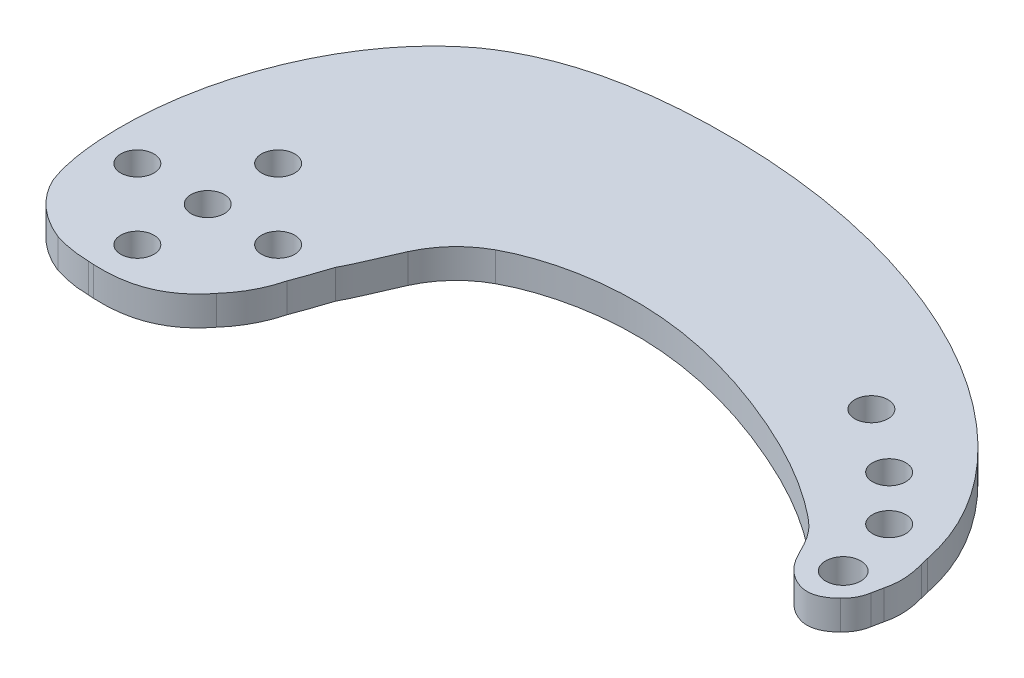
from build123d import *

# Parameters (mm, degrees)
SKETCH_1_R          = 1.7
EXTRUDE_1_DEPTH     = 3
CUT_EXTRUDE_3_DEPTH = 3
SKETCH_3_R          = 1.7
EXTRUDE_3_DEPTH     = 3
FILLET_9_R          = 10
FILLET_10_R         = 10
FILLET_14_R         = 20
EXTRUDE_4_DEPTH     = 3
CUT_EXTRUDE_4_DEPTH = 3
EXTRUDE_6_DEPTH     = 3
FILLET_20_R         = 10
FILLET_21_R         = 10
SKETCH_8_R          = 1.8
CUT_EXTRUDE_5_DEPTH = 3
SKETCH_9_R          = 1.7
CUT_EXTRUDE_6_DEPTH = 10


with BuildPart() as part:
    # 草图1 → 凸台-拉伸1 (new body)
    # profile 1 of 23: a face of its own
    with BuildSketch(Plane(origin=(0, 0, 0), x_dir=(1, 0, 0), z_dir=(0, 1, 0))):
        with BuildLine():
            ThreePointArc((5.5, 0), (7.2, 1.7), (8.9, 0))
            Line((8.9, 0), (11.2, 0))
            ThreePointArc((11.2, 0), (9.208552546, 6.375151763), (3.9424, 10.4832))
            ThreePointArc((3.9424, 10.4832), (2.837711379, 10.834546328), (1.702623658, 11.06982713))
            ThreePointArc((1.702623658, 11.06982713), (-7.292825757, 8.500276024), (-11.2, 0))
            Line((-11.2, 0), (-8.9, 0))
            ThreePointArc((-8.9, 0), (-7.2, 1.7), (-5.5, 0))
            Line((-5.5, 0), (-1.7, 0))
            ThreePointArc((-1.7, 0), (0, 1.7), (1.7, 0))
            Line((1.7, 0), (5.5, 0))
        make_face()
        with Locations(Location((0, 7.2, 0), (0, 0, 270))):
            Circle(SKETCH_1_R, mode=Mode.SUBTRACT)
    # profile 2 of 23: a face of its own
    with BuildSketch(Plane(origin=(0, 0, 0), x_dir=(1, 0, 0), z_dir=(0, 1, 0))):
        with BuildLine():
            Line((11.2, 0), (8.9, 0))
            ThreePointArc((8.9, 0), (7.2, -1.7), (5.5, 0))
            Line((5.5, 0), (1.7, 0))
            ThreePointArc((1.7, 0), (0, -1.7), (-1.7, 0))
            Line((-1.7, 0), (-5.5, 0))
            ThreePointArc((-5.5, 0), (-7.2, -1.7), (-8.9, 0))
            Line((-8.9, 0), (-11.2, 0))
            ThreePointArc((-11.2, 0), (0, -11.2), (11.2, 0))
        make_face()
        with Locations(Location((0, -7.2, 0), (0, 0, 270))):
            Circle(SKETCH_1_R, mode=Mode.SUBTRACT)
    # profile 3 of 23: a face of its own
    with BuildSketch(Plane(origin=(0, 0, 0), x_dir=(1, 0, 0), z_dir=(0, 1, 0))):
        with BuildLine():
            ThreePointArc((36.4, 25.2), (54.219090886, 17.819090886), (61.6, 0))
            ThreePointArc((61.6, 0), (62.902494764, 2.675905788), (65.812042226, 3.301603765))
            ThreePointArc((65.812042226, 3.301603765), (37.256587325, 36.064283099), (1.702623658, 11.06982713))
            ThreePointArc((1.702623658, 11.06982713), (2.837711379, 10.834546328), (3.9424, 10.4832))
            ThreePointArc((3.9424, 10.4832), (17.872608925, 22.911095384), (36.4, 25.2))
        make_face()
    # profile 4 of 23: a face of its own
    with BuildSketch(Plane(origin=(0, 0, 0), x_dir=(1, 0, 0), z_dir=(0, 1, 0))):
        with BuildLine():
            ThreePointArc((68.4, 0), (28.6, 39.8), (-11.2, 0))
            ThreePointArc((-11.2, 0), (-7.292825757, 8.500276024), (1.702623658, 11.06982713))
            ThreePointArc((1.702623658, 11.06982713), (37.256587325, 36.064283099), (65.812042226, 3.301603765))
            ThreePointArc((65.812042226, 3.301603765), (67.675905788, 2.097505236), (68.4, 0))
        make_face()
    # profile 5 of 23: a face of its own
    with BuildSketch(Plane(origin=(0, 0, 0), x_dir=(1, 0, 0), z_dir=(0, 1, 0))):
        with BuildLine():
            ThreePointArc((3.9424, 10.4832), (9.208552546, 6.375151763), (11.2, 0))
            ThreePointArc((11.2, 0), (18.580909114, 17.819090886), (36.4, 25.2))
            ThreePointArc((36.4, 25.2), (17.872608925, 22.911095384), (3.9424, 10.4832))
        make_face()
    # profile 6 of 23: a face of its own
    with BuildSketch(Plane(origin=(0, 0, 0), x_dir=(1, 0, 0), z_dir=(0, 1, 0))):
        with BuildLine():
            ThreePointArc((36.4, 25.2), (52.935943621, 16.535943621), (61.6, 0))
            ThreePointArc((61.6, 0), (54.219090886, 17.819090886), (36.4, 25.2))
        make_face()
    # profile 7 of 23: a face of its own
    with BuildSketch(Plane(origin=(0, 0, 0), x_dir=(1, 0, 0), z_dir=(0, 1, 0))):
        with BuildLine():
            ThreePointArc((65.812042226, 3.301603765), (62.902494764, 2.675905788), (61.6, 0))
            Line((61.6, 0), (63.3, 0))
            ThreePointArc((63.3, 0), (64.094189641, 1.438578324), (65.734714816, 1.533034291))
            ThreePointArc((65.734714816, 1.533034291), (65.785435342, 2.416791866), (65.812042226, 3.301603765))
        make_face()
    # profile 8 of 23: a face of its own
    with BuildSketch(Plane(origin=(0, 0, 0), x_dir=(1, 0, 0), z_dir=(0, 1, 0))):
        with BuildLine():
            Line((63.3, 0), (61.6, 0))
            ThreePointArc((61.6, 0), (62.595836944, -2.404163056), (65, -3.4))
            ThreePointArc((65, -3.4), (65.185488011, -2.534439938), (65.347308419, -1.664144483))
            ThreePointArc((65.347308419, -1.664144483), (63.927718394, -1.319171011), (63.3, 0))
        make_face()
    # profile 9 of 23: a face of its own
    with BuildSketch(Plane(origin=(0, 0, 0), x_dir=(1, 0, 0), z_dir=(0, 1, 0))):
        with BuildLine():
            ThreePointArc((65.347308419, -1.664144483), (65.185488011, -2.534439938), (65, -3.4))
            ThreePointArc((65, -3.4), (67.404163056, -2.404163056), (68.4, 0))
            Line((68.4, 0), (66.7, 0))
            ThreePointArc((66.7, 0), (66.319171011, -1.072281606), (65.347308419, -1.664144483))
        make_face()
    # profile 10 of 23: a face of its own
    with BuildSketch(Plane(origin=(0, 0, 0), x_dir=(1, 0, 0), z_dir=(0, 1, 0))):
        with BuildLine():
            ThreePointArc((68.4, 0), (67.675905788, 2.097505236), (65.812042226, 3.301603765))
            ThreePointArc((65.812042226, 3.301603765), (65.785435342, 2.416791866), (65.734714816, 1.533034291))
            ThreePointArc((65.734714816, 1.533034291), (66.438578324, 0.905810359), (66.7, 0))
            Line((66.7, 0), (68.4, 0))
        make_face()
    # profile 11 of 23: a face of its own
    with BuildSketch(Plane(origin=(0, 0, 0), x_dir=(1, 0, 0), z_dir=(0, 1, 0))):
        with BuildLine():
            ThreePointArc((65.812042226, 3.301603765), (62.902494764, 2.675905788), (61.6, 0))
            Line((61.6, 0), (63.3, 0))
            ThreePointArc((63.3, 0), (64.094189641, 1.438578324), (65.734714816, 1.533034291))
            ThreePointArc((65.734714816, 1.533034291), (65.785435342, 2.416791866), (65.812042226, 3.301603765))
        make_face()
    # profile 12 of 23: a face of its own
    with BuildSketch(Plane(origin=(0, 0, 0), x_dir=(1, 0, 0), z_dir=(0, 1, 0))):
        with BuildLine():
            Line((63.3, 0), (61.6, 0))
            ThreePointArc((61.6, 0), (62.595836944, -2.404163056), (65, -3.4))
            ThreePointArc((65, -3.4), (65.185488011, -2.534439938), (65.347308419, -1.664144483))
            ThreePointArc((65.347308419, -1.664144483), (63.927718394, -1.319171011), (63.3, 0))
        make_face()
    # profile 13 of 23: a face of its own
    with BuildSketch(Plane(origin=(0, 0, 0), x_dir=(1, 0, 0), z_dir=(0, 1, 0))):
        with BuildLine():
            ThreePointArc((65.347308419, -1.664144483), (65.185488011, -2.534439938), (65, -3.4))
            ThreePointArc((65, -3.4), (67.404163056, -2.404163056), (68.4, 0))
            Line((68.4, 0), (66.7, 0))
            ThreePointArc((66.7, 0), (66.319171011, -1.072281606), (65.347308419, -1.664144483))
        make_face()
    # profile 14 of 23: a face of its own
    with BuildSketch(Plane(origin=(0, 0, 0), x_dir=(1, 0, 0), z_dir=(0, 1, 0))):
        with BuildLine():
            ThreePointArc((68.4, 0), (67.675905788, 2.097505236), (65.812042226, 3.301603765))
            ThreePointArc((65.812042226, 3.301603765), (65.785435342, 2.416791866), (65.734714816, 1.533034291))
            ThreePointArc((65.734714816, 1.533034291), (66.438578324, 0.905810359), (66.7, 0))
            Line((66.7, 0), (68.4, 0))
        make_face()
    # profile 15 of 23: a face of its own
    with BuildSketch(Plane(origin=(0, 0, 0), x_dir=(1, 0, 0), z_dir=(0, 1, 0))):
        with BuildLine():
            ThreePointArc((65.812042226, 3.301603765), (62.902494764, 2.675905788), (61.6, 0))
            Line((61.6, 0), (63.3, 0))
            ThreePointArc((63.3, 0), (64.094189641, 1.438578324), (65.734714816, 1.533034291))
            ThreePointArc((65.734714816, 1.533034291), (65.785435342, 2.416791866), (65.812042226, 3.301603765))
        make_face()
    # profile 16 of 23: a face of its own
    with BuildSketch(Plane(origin=(0, 0, 0), x_dir=(1, 0, 0), z_dir=(0, 1, 0))):
        with BuildLine():
            Line((63.3, 0), (61.6, 0))
            ThreePointArc((61.6, 0), (62.595836944, -2.404163056), (65, -3.4))
            ThreePointArc((65, -3.4), (65.185488011, -2.534439938), (65.347308419, -1.664144483))
            ThreePointArc((65.347308419, -1.664144483), (63.927718394, -1.319171011), (63.3, 0))
        make_face()
    # profile 17 of 23: a face of its own
    with BuildSketch(Plane(origin=(0, 0, 0), x_dir=(1, 0, 0), z_dir=(0, 1, 0))):
        with BuildLine():
            ThreePointArc((65.347308419, -1.664144483), (65.185488011, -2.534439938), (65, -3.4))
            ThreePointArc((65, -3.4), (67.404163056, -2.404163056), (68.4, 0))
            Line((68.4, 0), (66.7, 0))
            ThreePointArc((66.7, 0), (66.319171011, -1.072281606), (65.347308419, -1.664144483))
        make_face()
    # profile 18 of 23: a face of its own
    with BuildSketch(Plane(origin=(0, 0, 0), x_dir=(1, 0, 0), z_dir=(0, 1, 0))):
        with BuildLine():
            ThreePointArc((68.4, 0), (67.675905788, 2.097505236), (65.812042226, 3.301603765))
            ThreePointArc((65.812042226, 3.301603765), (65.785435342, 2.416791866), (65.734714816, 1.533034291))
            ThreePointArc((65.734714816, 1.533034291), (66.438578324, 0.905810359), (66.7, 0))
            Line((66.7, 0), (68.4, 0))
        make_face()
    # profile 19 of 23: a face of its own
    with BuildSketch(Plane(origin=(0, 0, 0), x_dir=(1, 0, 0), z_dir=(0, 1, 0))):
        with BuildLine():
            ThreePointArc((65.812042226, 3.301603765), (62.902494764, 2.675905788), (61.6, 0))
            Line((61.6, 0), (63.3, 0))
            ThreePointArc((63.3, 0), (64.094189641, 1.438578324), (65.734714816, 1.533034291))
            ThreePointArc((65.734714816, 1.533034291), (65.785435342, 2.416791866), (65.812042226, 3.301603765))
        make_face()
    # profile 20 of 23: a face of its own
    with BuildSketch(Plane(origin=(0, 0, 0), x_dir=(1, 0, 0), z_dir=(0, 1, 0))):
        with BuildLine():
            Line((63.3, 0), (61.6, 0))
            ThreePointArc((61.6, 0), (62.595836944, -2.404163056), (65, -3.4))
            ThreePointArc((65, -3.4), (65.185488011, -2.534439938), (65.347308419, -1.664144483))
            ThreePointArc((65.347308419, -1.664144483), (63.927718394, -1.319171011), (63.3, 0))
        make_face()
    # profile 21 of 23: a face of its own
    with BuildSketch(Plane(origin=(0, 0, 0), x_dir=(1, 0, 0), z_dir=(0, 1, 0))):
        with BuildLine():
            ThreePointArc((65.347308419, -1.664144483), (65.185488011, -2.534439938), (65, -3.4))
            ThreePointArc((65, -3.4), (67.404163056, -2.404163056), (68.4, 0))
            Line((68.4, 0), (66.7, 0))
            ThreePointArc((66.7, 0), (66.319171011, -1.072281606), (65.347308419, -1.664144483))
        make_face()
    # profile 22 of 23: a face of its own
    with BuildSketch(Plane(origin=(0, 0, 0), x_dir=(1, 0, 0), z_dir=(0, 1, 0))):
        with BuildLine():
            ThreePointArc((68.4, 0), (67.675905788, 2.097505236), (65.812042226, 3.301603765))
            ThreePointArc((65.812042226, 3.301603765), (65.785435342, 2.416791866), (65.734714816, 1.533034291))
            ThreePointArc((65.734714816, 1.533034291), (66.438578324, 0.905810359), (66.7, 0))
            Line((66.7, 0), (68.4, 0))
        make_face()
    # profile 23 of 23: a face of its own
    with BuildSketch(Plane(origin=(0, 0, 0), x_dir=(1, 0, 0), z_dir=(0, 1, 0))):
        with BuildLine():
            ThreePointArc((36.4, 25.2), (18.580909114, 17.819090886), (11.2, 0))
            Line((11.2, 0), (61.6, 0))
            ThreePointArc((61.6, 0), (52.935943621, 16.535943621), (36.4, 25.2))
        make_face()
    extrude(amount=EXTRUDE_1_DEPTH)

    # 草图2 → 切除-拉伸3 (cut)
    with BuildSketch(Plane(origin=(0, 0, 0), x_dir=(1, 0, 0), z_dir=(0, 1, 0))):
        with BuildLine():
            Line((68.849577541, -5.350147526), (79.418255921, 26.798886108))
            Line((79.418255921, 26.798886108), (41.510241853, 45.721250392))
            Line((41.510241853, 45.721250392), (-3.738890131, 40.215411955))
            Line((-3.738890131, 40.215411955), (-19.437922992, 8.764841107))
            Line((-19.437922992, 8.764841107), (-13.991141015, 0))
            Line((-13.991141015, 0), (-11.2, 0))
            add(Edge.make_bspline(
                [(-11.2, 0), (-10.98570603, 9.511964616), (-6.790384007, 26.883440864), (30.257690246, 38.217930428), (69.370809067, 18.750082571), (68.849577541, -5.350147526)],
                knots=[0, 0, 0, 0, 0.267985993, 0.373432138, 1, 1, 1, 1], degree=3))
        make_face()
        with BuildLine():
            Line((11.2, 0), (61.6, 0))
            add(Edge.make_bspline(
                [(11.2, 0), (14.907237051, 24.878878013), (54.036546726, 12.1796003), (61.6, 0)],
                knots=[0, 0, 0, 0, 1, 1, 1, 1], degree=3))
        make_face()
    extrude(amount=CUT_EXTRUDE_3_DEPTH, mode=Mode.SUBTRACT)

    # 草图3 → 凸台-拉伸3 (add)
    with BuildSketch(Plane(origin=(0, 0, 0), x_dir=(1, 0, 0), z_dir=(0, 1, 0))):
        with Locations((65, 0)):
            Circle(SKETCH_3_R)
        with BuildLine():
            add(Edge.make_bspline(
                [(11.2, 0), (12.445613849, -0.056946933), (16.571407935, 16.802360329), (35.788824905, 14.252683642), (51.249640161, 9.442422377), (60.238259143, 2.741563074), (64.770360278, -5.187357593), (69.206577143, -0.002495132), (68.396099439, 6.376713893), (55.968118328, 24.950216267), (5.625904457, 36.508565927), (9.990497003, 0.055296018), (11.2, 0)],
                knots=[0, 0, 0, 0, 0.081161217, 0.198317789, 0.331056992, 0.406547513, 0.438622354, 0.470697196, 0.501390038, 0.565670643, 0.92119168, 1, 1, 1, 1], degree=3))
        make_face()
    extrude(amount=EXTRUDE_3_DEPTH)

    # 圆角9
    fillet_9_edges = [part.edges().sort_by_distance(p)[0] for p in [
        (17.059648691, 1.5, -10.662861344),
        (11.2, 1.5, 0),
    ]]
    fillet(fillet_9_edges, radius=FILLET_9_R)

    # 圆角10
    fillet_10_edges = [part.edges().sort_by_distance(p)[0] for p in [
        (68.4, 1.5, 0),
        (61.6, 1.5, 0),
    ]]
    fillet(fillet_10_edges, radius=FILLET_10_R)

    # 圆角14
    fillet_14_edges = [part.edges().sort_by_distance(p)[0] for p in [
        (59.25376733, 1.5, -16.163619627),
    ]]
    fillet(fillet_14_edges, radius=FILLET_14_R)

    # 草图4 → 凸台-拉伸4 (add)
    with BuildSketch(Plane(origin=(0, 0, 0), x_dir=(1, 0, 0), z_dir=(0, 1, 0))):
        with BuildLine():
            Line((5.205364174, -8.263457931), (-0.456140463, -10.299055104))
            Line((-0.456140463, -10.299055104), (-8.725753977, -3.492527057))
            Line((-8.725753977, -3.492527057), (-9.61632774, 1.660078286))
            Line((-9.61632774, 1.660078286), (-4.051653355, 17.482622071))
            Line((-4.051653355, 17.482622071), (31.159228128, 24.115259599))
            Line((31.159228128, 24.115259599), (64.810193891, 6.04933469))
            Line((64.810193891, 6.04933469), (67.227465534, 0))
            Line((67.227465534, 0), (68.363274916, -0.498379212))
            add(Edge.make_bspline(
                [(68.363274916, -0.498379212), (69.532708963, 7.730280313), (60.738469504, 20.627242961), (41.024169704, 30.636446502), (20.620918144, 33.805709868), (-5.259875882, 29.990734693), (-13.072652033, 6.858797725), (-10.268154966, -6.40085846), (-7.775524094, -9.61750499), (-6.466783991, -9.922623082), (-2.26188398, -11.569131778), (2.33580519, -11.773246089), (5.205364174, -8.263457931)],
                knots=[0, 0, 0, 0, 0.167183895, 0.308915578, 0.466622559, 0.613185698, 0.827690468, 0.89009779, 0.902058544, 0.911312027, 0.918105774, 1, 1, 1, 1], degree=3))
        make_face()
    extrude(amount=EXTRUDE_4_DEPTH)

    # 草图6 → 切除-拉伸4 (cut)
    with BuildSketch(Plane(origin=(0, 0, 0), x_dir=(1, 0, 0), z_dir=(0, 1, 0))):
        with BuildLine():
            Line((6.198074913, 30.769413247), (-15.201438159, 29.11441495))
            Line((-15.201438159, 29.11441495), (-14.174464608, -13.890102476))
            Line((-14.174464608, -13.890102476), (0, -13.551607799))
            Line((0, -13.551607799), (-1.07082991, -11.148691551))
            add(Edge.make_bspline(
                [(-1.07082991, -11.148691551), (-4.632098822, -11.372542323), (-9.743745913, -8.365778862), (-10.905982833, -2.80619952), (-12.563842534, 11.227564879), (-5.891605094, 27.30233233), (6.198074913, 30.769413247)],
                knots=[0, 0, 0, 0, 0.203093444, 0.264365632, 0.313017022, 1, 1, 1, 1], degree=3))
        make_face()
    extrude(amount=CUT_EXTRUDE_4_DEPTH, mode=Mode.SUBTRACT)

    # 草图7 → 凸台-拉伸6 (add)
    with BuildSketch(Plane(origin=(0, 3, 0), x_dir=(1, 0, 0), z_dir=(0, 1, 0))):
        with BuildLine():
            Line((67.267592809, -2.533381703), (62.796727439, -1.544387585))
            Line((62.796727439, -1.544387585), (59.283028619, 6.962462189))
            Line((59.283028619, 6.962462189), (25.589630625, 20.161737938))
            Line((25.589630625, 20.161737938), (9.982664815, 8.020864686))
            Line((9.982664815, 8.020864686), (9.982664815, 0))
            Line((9.982664815, 0), (6.138584566, -6.823705409))
            Line((6.138584566, -6.823705409), (-0.550115067, -10.360259238))
            Line((-0.550115067, -10.360259238), (-1.07082991, -11.148691551))
            add(Edge.make_bspline(
                [(-1.07082991, -11.148691551), (7.812669668, -11.919550611), (10.96181155, -2.856059757), (14.781270798, 9.242340193), (28.533124839, 15.181959499), (44.177561896, 11.550637389), (55.332290754, 5.54631354), (59.457312788, 2.134315772), (60.7283813, 0.393004228), (61.584454582, -1.828142583), (63.337302433, -3.344243945), (65.436862479, -3.898295904), (66.710060657, -3.145429133), (67.267592809, -2.533381703)],
                knots=[0, 0, 0, 0, 0.226108574, 0.31746352, 0.429095875, 0.705433638, 0.851538596, 0.872297984, 0.892425071, 0.926476328, 0.954706086, 0.970022879, 1, 1, 1, 1], degree=3))
        make_face()
    extrude(amount=-EXTRUDE_6_DEPTH)

    # 圆角20
    fillet_20_edges = [part.edges().sort_by_distance(p)[0] for p in [
        (15.414387437, 1.5, -8.020864686),
    ]]
    fillet(fillet_20_edges, radius=FILLET_20_R)

    # 圆角21
    fillet_21_edges = [part.edges().sort_by_distance(p)[0] for p in [
        (68.280862162, 1.5, -5.005189784),
    ]]
    fillet(fillet_21_edges, radius=FILLET_21_R)

    # 草图8 → 切除-拉伸5 (cut)
    with BuildSketch(Plane(origin=(0, 0, 0), x_dir=(1, 0, 0), z_dir=(0, 1, 0))):
        with Locations(Location((65, 0, 0), (0, 0, 270))):
            Circle(SKETCH_8_R)
    extrude(amount=CUT_EXTRUDE_5_DEPTH, mode=Mode.SUBTRACT)

    # 草图9 → 切除-拉伸6 (cut)
    with BuildSketch(Plane(origin=(0, 0, 0), x_dir=(1, 0, 0), z_dir=(0, 1, 0))):
        with Locations(Location((63.2, 6.5, 0), (0, 0, 270))):
            Circle(SKETCH_9_R)
        with Locations(Location((58.603805922, 11.096194078, 0), (0, 0, 270))):
            Circle(SKETCH_9_R)
        with Locations(Location((52.110193676, 15.768773665, 0), (0, 0, 270))):
            Circle(SKETCH_9_R)
    extrude(amount=CUT_EXTRUDE_6_DEPTH, mode=Mode.SUBTRACT)


solid = part.part
